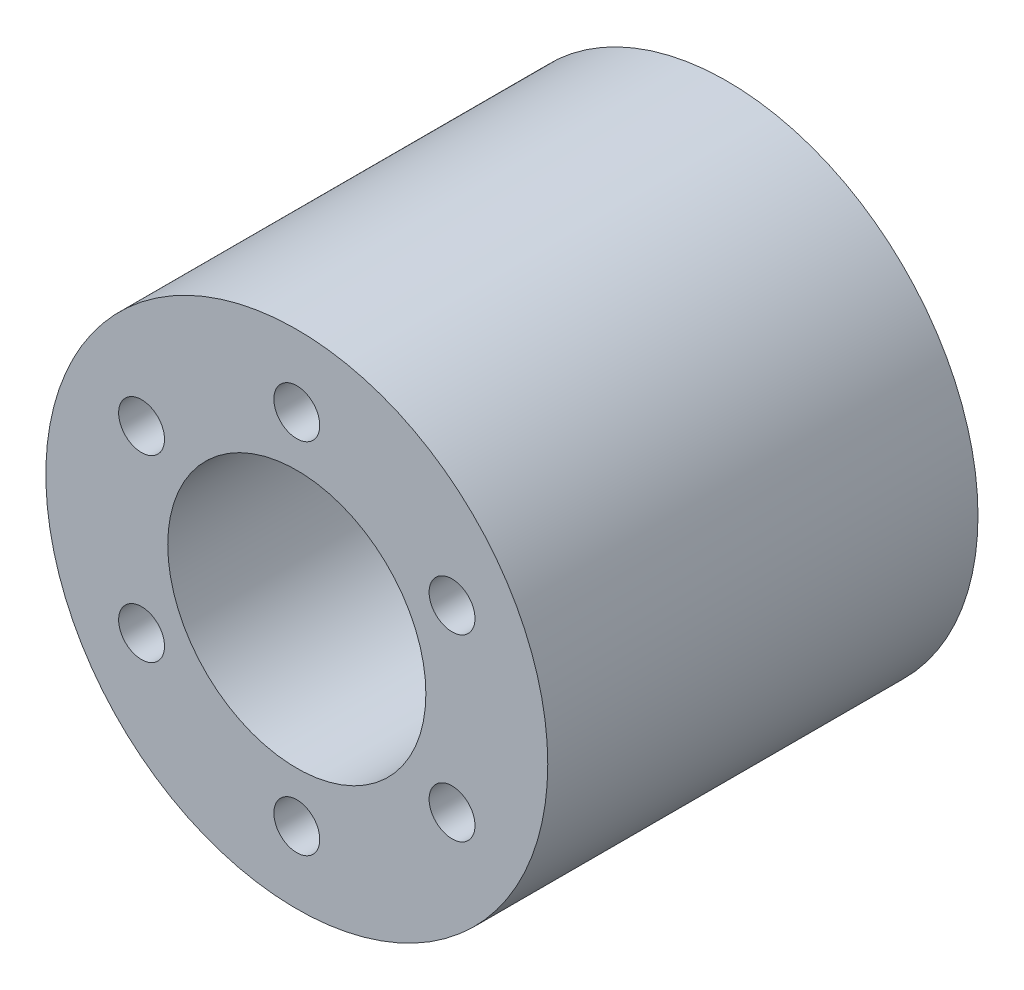
from build123d import *

# Parameters (mm, degrees)
SKETCH1_R           = 17.5
SKETCH1_R_2         = 1.6
SKETCH1_R_3         = 9
BOSS_EXTRUDE1_DEPTH = 30


with BuildPart() as part:
    # Sketch1 → Boss-Extrude1 (new body)
    with BuildSketch(Plane.XY):
        Circle(SKETCH1_R)
        with Locations((0, 12.5)):
            Circle(SKETCH1_R_2, mode=Mode.SUBTRACT)
        with Locations((10.825317547, 6.25)):
            Circle(SKETCH1_R_2, mode=Mode.SUBTRACT)
        with Locations((10.825317547, -6.25)):
            Circle(SKETCH1_R_2, mode=Mode.SUBTRACT)
        with Locations((0, -12.5)):
            Circle(SKETCH1_R_2, mode=Mode.SUBTRACT)
        with Locations((-10.825317547, -6.25)):
            Circle(SKETCH1_R_2, mode=Mode.SUBTRACT)
        with Locations((-10.825317547, 6.25)):
            Circle(SKETCH1_R_2, mode=Mode.SUBTRACT)
        Circle(SKETCH1_R_3, mode=Mode.SUBTRACT)
    extrude(amount=BOSS_EXTRUDE1_DEPTH)


solid = part.part
